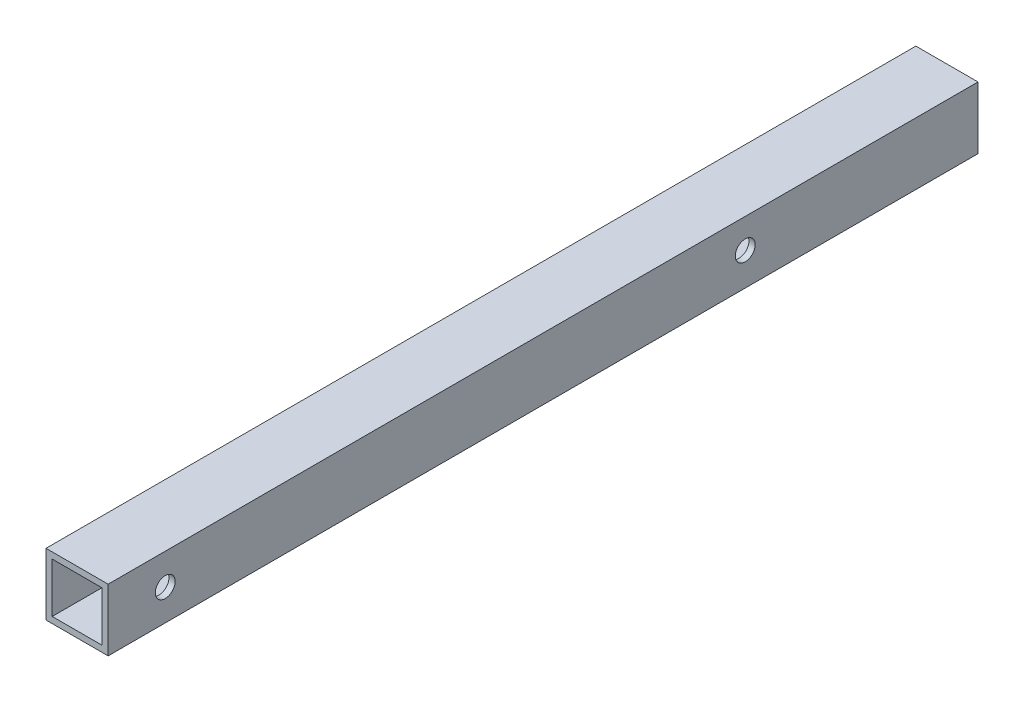
from build123d import *

# Parameters (mm, degrees)
SKETCH_1_W          = 10
SKETCH_1_H          = 10
SKETCH_1_W_2        = 8
SKETCH_1_H_2        = 8
EXTRUDE_1_DEPTH     = 140
SKETCH_2_R          = 1.6
CUT_EXTRUDE_1_DEPTH = 141.445719052
SKETCH_3_R          = 1.6
CUT_EXTRUDE_2_DEPTH = 141.445719052


with BuildPart() as part:
    # ｽｹｯﾁ1 → ﾎﾞｽ - 押し出し1 (new body)
    with BuildSketch(Plane.XY):
        Rectangle(SKETCH_1_W, SKETCH_1_H)
        Rectangle(SKETCH_1_W_2, SKETCH_1_H_2, mode=Mode.SUBTRACT)
    extrude(amount=EXTRUDE_1_DEPTH)

    # ｽｹｯﾁ2 → ｶｯﾄ - 押し出し1 (cut, through all)
    with BuildSketch(Plane(origin=(5, 0, 0), x_dir=(0, 0, -1), z_dir=(1, 0, 0))):
        with Locations(Location((-130.81, 0, 0), (0, 0, 90))):
            Circle(SKETCH_2_R)
    extrude(amount=-CUT_EXTRUDE_1_DEPTH, mode=Mode.SUBTRACT)

    # ｽｹｯﾁ3 → ｶｯﾄ - 押し出し2 (cut, through all)
    with BuildSketch(Plane(origin=(5, 0, 0), x_dir=(0, 0, -1), z_dir=(1, 0, 0))):
        with Locations(Location((-37.465120214, 0.258526647, 0), (0, 0, 90))):
            Circle(SKETCH_3_R)
    extrude(amount=-CUT_EXTRUDE_2_DEPTH, mode=Mode.SUBTRACT)


solid = part.part
